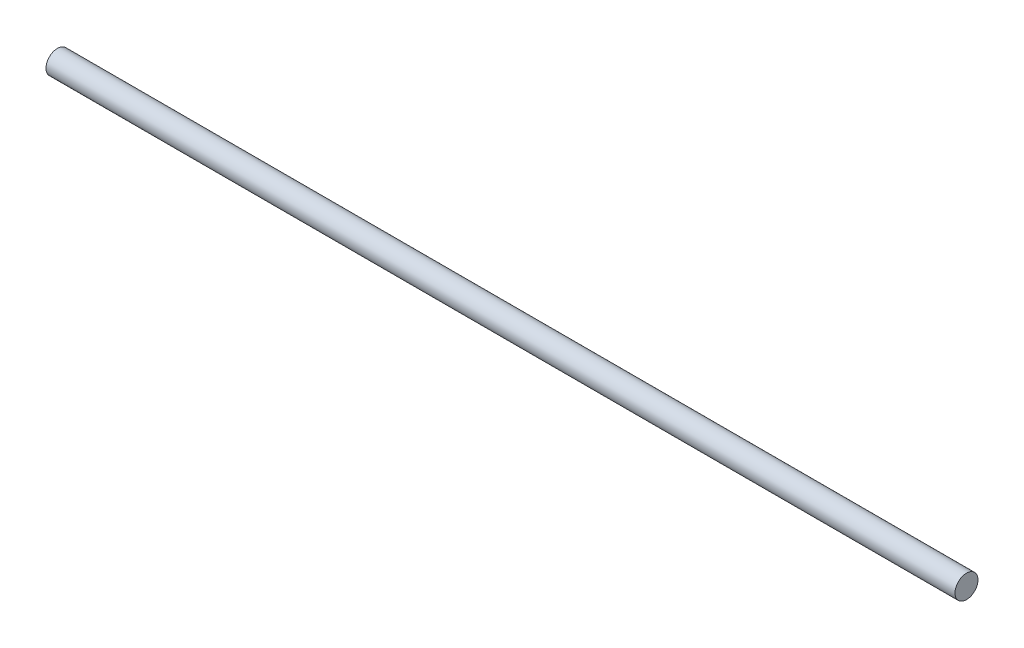
from build123d import *

# Parameters (mm, degrees)
SKETCH1_R           = 6.35
BOSS_EXTRUDE1_DEPTH = 501.65


with BuildPart() as part:
    # Sketch1 → Boss-Extrude1 (new body)
    with BuildSketch(Plane(origin=(0, 0, 0), x_dir=(0, 0, -1), z_dir=(1, 0, 0))):
        Circle(SKETCH1_R)
    extrude(amount=BOSS_EXTRUDE1_DEPTH)


solid = part.part
